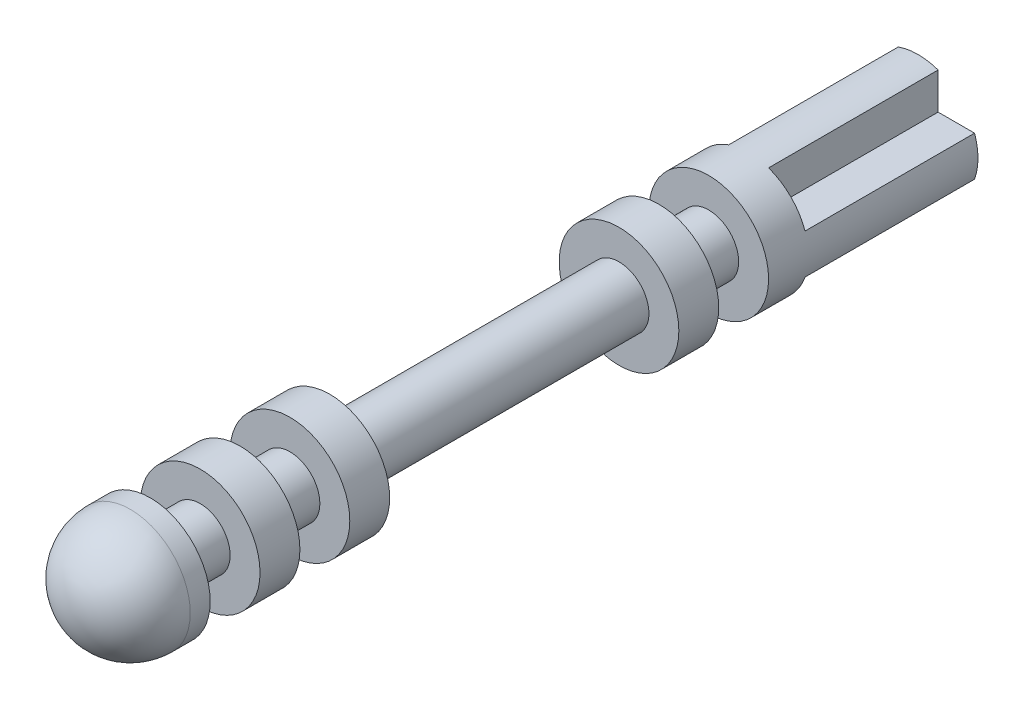
from build123d import *

# Parameters (mm, degrees)
SKETCH_1_R                                = 3
EXTRUDE_1_DEPTH                           = 10.5
SKETCH_3_R                                = 1.5
EXTRUDE_2_DEPTH                           = 13
SKETCH_4_R                                = 3
EXTRUDE_3_DEPTH                           = 2
SKETCH_5_R                                = 1.5
EXTRUDE_4_DEPTH                           = 38.5
EXTRUDE_START                             = 29.5
SKETCH_7_R                                = 3
EXTRUDE_5_DEPTH                           = 2
EXTRUDE_START_2                           = 34
SKETCH_8_R                                = 3
EXTRUDE_6_DEPTH                           = 2
SKETCH_9_R                                = 3
EXTRUDE_7_DEPTH                           = 4
FILLET_1_R                                = 3
CUT_EXTRUDE_START                         = -8.5
CUT_EXTRUDE_1_DEPTH                       = 52.211239739
MIRROR_START                              = -8.5
MIRROR_2_AT_THE_SECOND_PLANE_COPY_1_DEPTH = 52.211239739


with BuildPart() as part:
    # 草图1 → 凸台-拉伸1 (new body)
    with BuildSketch(Plane.XY):
        with Locations(Location((0, 0, 0), (0, 0, 180))):
            Circle(SKETCH_1_R)
    extrude(amount=EXTRUDE_1_DEPTH)

    # 草图3 → 凸台-拉伸2 (add)
    with BuildSketch(Plane.XY):
        with Locations(Location((0, 0, 0), (0, 0, 180))):
            Circle(SKETCH_3_R)
    extrude(amount=EXTRUDE_2_DEPTH)

    # 草图4 → 凸台-拉伸3 (add)
    with BuildSketch(Plane.XY.offset(13)):
        with Locations(Location((0, 0, 0), (0, 0, 180))):
            Circle(SKETCH_4_R)
    extrude(amount=EXTRUDE_3_DEPTH)

    # 草图5 → 凸台-拉伸4 (add)
    with BuildSketch(Plane.XY):
        with Locations(Location((0, 0, 0), (0, 0, 180))):
            Circle(SKETCH_5_R)
    extrude(amount=EXTRUDE_4_DEPTH)

    # 草图7 → 凸台-拉伸5 (add)
    with BuildSketch(Plane.XY.offset(EXTRUDE_START)):
        with Locations(Location((0, 0, 0), (0, 0, 180))):
            Circle(SKETCH_7_R)
    extrude(amount=EXTRUDE_5_DEPTH)

    # 草图8 → 凸台-拉伸6 (add)
    with BuildSketch(Plane.XY.offset(EXTRUDE_START_2)):
        with Locations(Location((0, 0, 0), (0, 0, 180))):
            Circle(SKETCH_8_R)
    extrude(amount=EXTRUDE_6_DEPTH)

    # 草图9 → 凸台-拉伸7 (add)
    with BuildSketch(Plane.XY.offset(38.5)):
        with Locations(Location((0, 0, 0), (0, 0, 180))):
            Circle(SKETCH_9_R)
    extrude(amount=EXTRUDE_7_DEPTH)

    # 圆角1
    fillet_1_edges = [part.edges().sort_by_distance(p)[0] for p in [
        (3, 0, 42.5),
    ]]
    fillet(fillet_1_edges, radius=FILLET_1_R)

    # 草图10 → 切除-拉伸1 (cut)
    with BuildSketch(Plane(origin=(0, 0, 0), x_dir=(-1, 0, 0), z_dir=(0, 0, -1)).offset(CUT_EXTRUDE_START)):
        Polygon((-26.96639908, 1), (-2.828427125, 1), (-1, 1), (-1, 2.828427125), (-1, 26.96639908), (-35.136247307, 61.102646386), (-61.102646386, 35.136247307), align=None)
    cut_extrude_1 = extrude(amount=CUT_EXTRUDE_1_DEPTH, mode=Mode.SUBTRACT)

    # 镜向2: 切除-拉伸1 across plane
    add(cut_extrude_1.mirror(Plane.ZX), mode=Mode.SUBTRACT)

    # 镜向2 at the second plane: 切除-拉伸1 across plane
    add(cut_extrude_1.mirror(Plane(origin=(0, 0, 0), x_dir=(0, 0, 1), z_dir=(1, 0, 0))), mode=Mode.SUBTRACT)

    # 镜向2 at the second plane copy 1 sket → 镜向2 at the second plane copy 1 (cut)
    with BuildSketch(Plane(origin=(0, 0, 0), x_dir=(1, 0, 0), z_dir=(0, 0, -1)).offset(MIRROR_START)):
        Polygon((-26.96639908, 1), (-2.828427125, 1), (-1, 1), (-1, 2.828427125), (-1, 26.96639908), (-35.136247307, 61.102646386), (-61.102646386, 35.136247307), align=None)
    extrude(amount=MIRROR_2_AT_THE_SECOND_PLANE_COPY_1_DEPTH, mode=Mode.SUBTRACT)


solid = part.part
